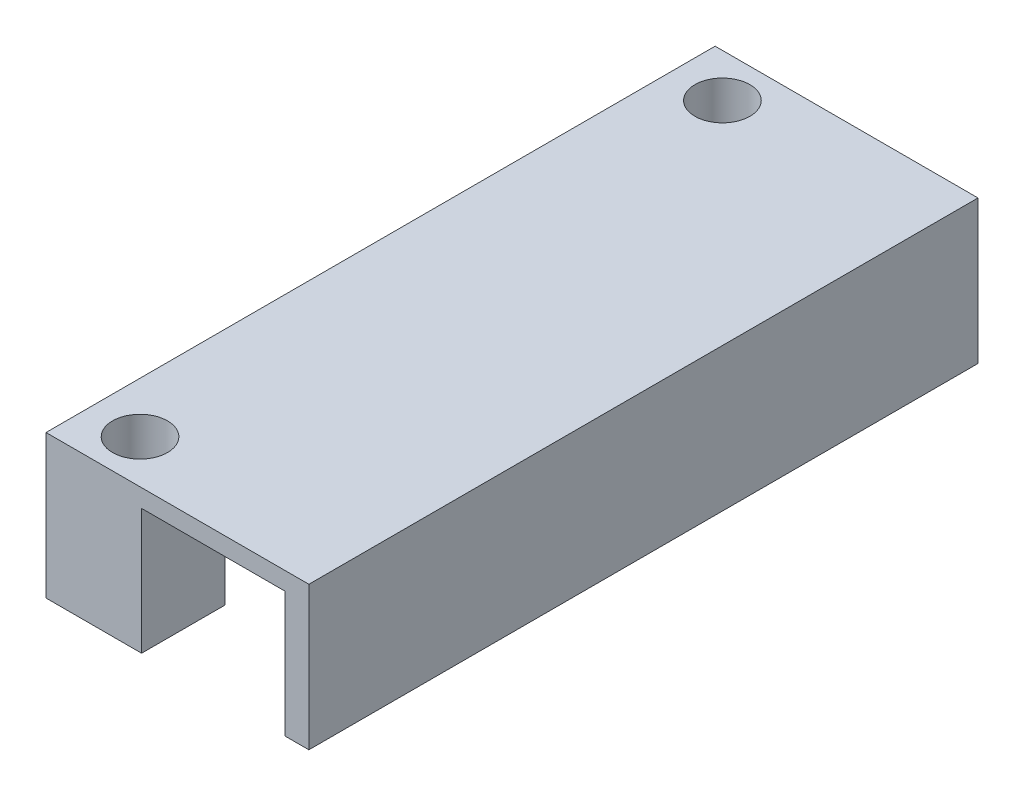
from build123d import *

# Parameters (mm, degrees)
SKETCH1_R           = 2.3
BOSS_EXTRUDE2_DEPTH = 12
CUT_EXTRUDE1_DEPTH  = 10.5
BOSS_EXTRUDE3_START = -1.5
SKETCH4_W           = 22
SKETCH4_H           = 1
BOSS_EXTRUDE3_DEPTH = 12
SKETCH5_W           = 12
SKETCH5_H           = 56
CUT_EXTRUDE2_DEPTH  = 10.5


with BuildPart() as part:
    # Sketch1 → Boss-Extrude2 (new body)
    with BuildSketch(Plane(origin=(0, 0, 0), x_dir=(1, 0, 0), z_dir=(0, 1, 0))):
        Polygon((12, 27), (12, -27), (10, -27), (-10, -27), (-10, -20), (-10, 20), (-10, 27), (10, 27), align=None)
        with Locations(Location((-5.76, 24.37, 0), (0, 0, 270))):
            Circle(SKETCH1_R, mode=Mode.SUBTRACT)
        with Locations(Location((-5.76, -24.37, 0), (0, 0, 270))):
            Circle(SKETCH1_R, mode=Mode.SUBTRACT)
    extrude(amount=BOSS_EXTRUDE2_DEPTH)

    # Sketch3 → Cut-Extrude1 (cut)
    with BuildSketch(Plane.XZ):
        Polygon((10, 27), (-2, 27), (-2, 21), (-10, 21), (-10, -21), (-2, -21), (-2, -27), (10, -27), align=None)
    extrude(amount=-CUT_EXTRUDE1_DEPTH, mode=Mode.SUBTRACT)

    # Sketch4 → Boss-Extrude3 (add)
    with BuildSketch(Plane.XZ.offset(-10.5).offset(BOSS_EXTRUDE3_START)):
        with Locations((1, 27.5)):
            Rectangle(SKETCH4_W, SKETCH4_H)
        with Locations((1, -27.5)):
            Rectangle(SKETCH4_W, SKETCH4_H)
    extrude(amount=BOSS_EXTRUDE3_DEPTH)

    # Sketch5 → Cut-Extrude2 (cut)
    with BuildSketch(Plane.XZ.offset(-10.5)):
        with Locations((4, 0)):
            Rectangle(SKETCH5_W, SKETCH5_H)
    extrude(amount=CUT_EXTRUDE2_DEPTH, mode=Mode.SUBTRACT)


solid = part.part
